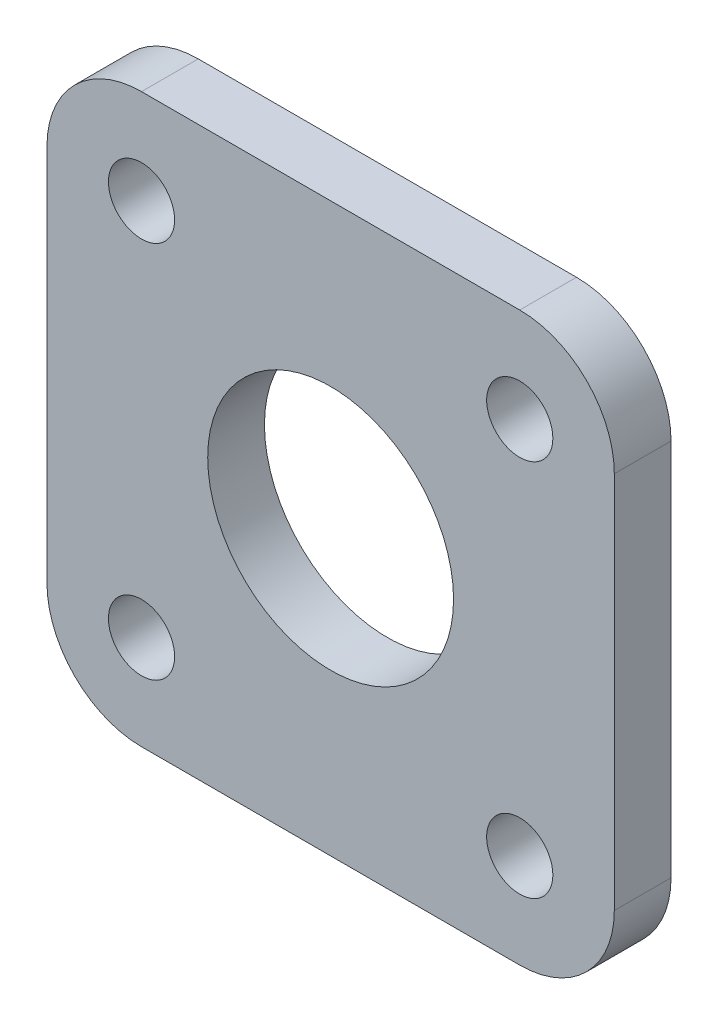
from build123d import *

# Parameters (mm, degrees)
SKETCH1_R           = 6.5
SKETCH1_R_2         = 1.75
BOSS_EXTRUDE1_DEPTH = 3


with BuildPart() as part:
    # Sketch1 → Boss-Extrude1 (new body)
    with BuildSketch(Plane.XY):
        with BuildLine():
            Line((-10, 15), (10, 15))
            ThreePointArc((10, 15), (13.535533906, 13.535533906), (15, 10))
            Line((15, 10), (15, -10))
            ThreePointArc((15, -10), (13.535533906, -13.535533906), (10, -15))
            Line((10, -15), (-10, -15))
            ThreePointArc((-10, -15), (-13.535533906, -13.535533906), (-15, -10))
            Line((-15, -10), (-15, 10))
            ThreePointArc((-15, 10), (-13.535533906, 13.535533906), (-10, 15))
        make_face()
        Circle(SKETCH1_R, mode=Mode.SUBTRACT)
        with Locations((-10, 10)):
            Circle(SKETCH1_R_2, mode=Mode.SUBTRACT)
        with Locations((10, 10)):
            Circle(SKETCH1_R_2, mode=Mode.SUBTRACT)
        with Locations((10, -10)):
            Circle(SKETCH1_R_2, mode=Mode.SUBTRACT)
        with Locations((-10, -10)):
            Circle(SKETCH1_R_2, mode=Mode.SUBTRACT)
    extrude(amount=BOSS_EXTRUDE1_DEPTH)


solid = part.part
